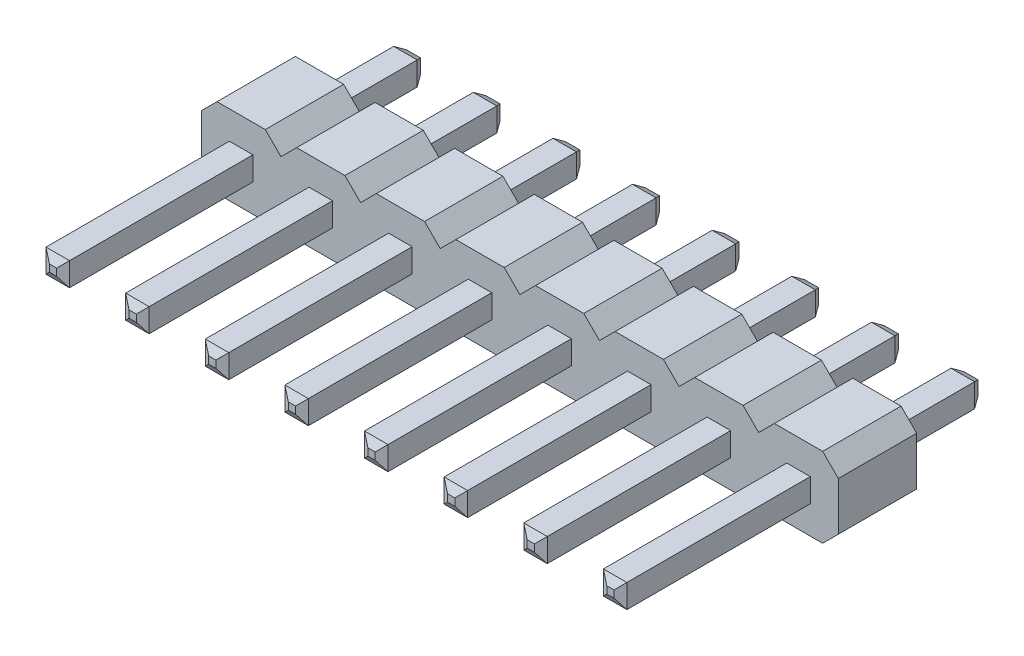
from build123d import *
from OCP.BRepFilletAPI import BRepFilletAPI_MakeChamfer

# Parameters (mm, degrees)
SKICA1_W                     = 0.75
SKICA1_H                     = 0.75
P_IDAT_VYSUNUT_M1_DEPTH      = 2.5
LINPOLE3_COUNT               = 8
LINPOLE3_PITCH               = 2.54
P_IDAT_VYSUNUT_M2_DEPTH      = 6
P_IDAT_VYSUNUT_M2_DEPTH_BACK = 5.5
SKICA2_W                     = 0.75
SKICA2_H                     = 0.75
ZKOSEN_2_SIZE                = 0.15
ZKOSEN_2_SIZE2               = 0.259807621


with BuildPart() as part:
    # Skica1 → Přidat vysunutím1 (new body)
    with BuildSketch(Plane.XY):
        Polygon((0.77, 1.27), (1.27, 0.77), (1.27, -0.77), (0.77, -1.27), (-0.77, -1.27), (-1.27, -0.77), (-1.27, 0.77), (-0.77, 1.27), align=None)
        Rectangle(SKICA1_W, SKICA1_H, mode=Mode.SUBTRACT)
    p_idat_vysunut_m1 = extrude(amount=P_IDAT_VYSUNUT_M1_DEPTH)

    # LinPole3: Přidat vysunutím1 ×8
    with Locations(*[(-i * LINPOLE3_PITCH, 0, 0) for i in range(1, LINPOLE3_COUNT)]):
        add(p_idat_vysunut_m1)

    # Skica2 → Přidat vysunutím2 (add, two sides: drawn at the far end of the back side and taken through both)
    with BuildSketch(Plane.XY.offset(2.5).offset(-P_IDAT_VYSUNUT_M2_DEPTH_BACK)):
        with Locations((-17.78, 0)):
            Rectangle(SKICA2_W, SKICA2_H)
        with Locations((-15.24, 0)):
            Rectangle(SKICA2_W, SKICA2_H)
        with Locations((-12.7, 0)):
            Rectangle(SKICA2_W, SKICA2_H)
        with Locations((-10.16, 0)):
            Rectangle(SKICA2_W, SKICA2_H)
        with Locations((-7.62, 0)):
            Rectangle(SKICA2_W, SKICA2_H)
        with Locations((-5.08, 0)):
            Rectangle(SKICA2_W, SKICA2_H)
        with Locations((-2.54, 0)):
            Rectangle(SKICA2_W, SKICA2_H)
        Rectangle(SKICA2_W, SKICA2_H)
    extrude(amount=P_IDAT_VYSUNUT_M2_DEPTH + P_IDAT_VYSUNUT_M2_DEPTH_BACK)

    # Zkosení2: one chamfer whose edges measure the first distance from different faces: ONE call of the kernel's chamfer builder (chamfer() names one face for all edges)
    zkosen_2_edges_1 = [part.edges().sort_by_distance(p)[0] for p in [
        (0, 0.375, -3),
        (0.375, 0, -3),
        (0, -0.375, -3),
        (-0.375, 0, -3),
    ]]
    zkosen_2_side_1 = [part.faces().sort_by_distance(p)[0] for p in [
        (0, 0, -3),
    ]]
    zkosen_2_edges_2 = [part.edges().sort_by_distance(p)[0] for p in [
        (0, 0.375, 8.5),
    ]]
    zkosen_2_side_2 = [part.faces().sort_by_distance(p)[0] for p in [
        (0, 0.375, 5.5),
    ]]
    zkosen_2_edges_3 = [part.edges().sort_by_distance(p)[0] for p in [
        (-0.375, 0, 8.5),
    ]]
    zkosen_2_side_3 = [part.faces().sort_by_distance(p)[0] for p in [
        (-0.375, 0, 5.5),
    ]]
    zkosen_2_edges_4 = [part.edges().sort_by_distance(p)[0] for p in [
        (0, -0.375, 8.5),
    ]]
    zkosen_2_side_4 = [part.faces().sort_by_distance(p)[0] for p in [
        (0, -0.375, 5.5),
    ]]
    zkosen_2_edges_5 = [part.edges().sort_by_distance(p)[0] for p in [
        (0.375, 0, 8.5),
    ]]
    zkosen_2_side_5 = [part.faces().sort_by_distance(p)[0] for p in [
        (0.375, 0, 5.5),
    ]]
    zkosen_2_edges_6 = [part.edges().sort_by_distance(p)[0] for p in [
        (-2.54, 0.375, -3),
        (-2.165, 0, -3),
        (-2.54, -0.375, -3),
        (-2.915, 0, -3),
    ]]
    zkosen_2_side_6 = [part.faces().sort_by_distance(p)[0] for p in [
        (-2.54, 0, -3),
    ]]
    zkosen_2_edges_7 = [part.edges().sort_by_distance(p)[0] for p in [
        (-2.54, 0.375, 8.5),
    ]]
    zkosen_2_side_7 = [part.faces().sort_by_distance(p)[0] for p in [
        (-2.54, 0.375, 5.5),
    ]]
    zkosen_2_edges_8 = [part.edges().sort_by_distance(p)[0] for p in [
        (-2.915, 0, 8.5),
    ]]
    zkosen_2_side_8 = [part.faces().sort_by_distance(p)[0] for p in [
        (-2.915, 0, 5.5),
    ]]
    zkosen_2_edges_9 = [part.edges().sort_by_distance(p)[0] for p in [
        (-2.54, -0.375, 8.5),
    ]]
    zkosen_2_side_9 = [part.faces().sort_by_distance(p)[0] for p in [
        (-2.54, -0.375, 5.5),
    ]]
    zkosen_2_edges_10 = [part.edges().sort_by_distance(p)[0] for p in [
        (-2.165, 0, 8.5),
    ]]
    zkosen_2_side_10 = [part.faces().sort_by_distance(p)[0] for p in [
        (-2.165, 0, 5.5),
    ]]
    zkosen_2_edges_11 = [part.edges().sort_by_distance(p)[0] for p in [
        (-5.08, 0.375, -3),
        (-4.705, 0, -3),
        (-5.08, -0.375, -3),
        (-5.455, 0, -3),
    ]]
    zkosen_2_side_11 = [part.faces().sort_by_distance(p)[0] for p in [
        (-5.08, 0, -3),
    ]]
    zkosen_2_edges_12 = [part.edges().sort_by_distance(p)[0] for p in [
        (-5.08, 0.375, 8.5),
    ]]
    zkosen_2_side_12 = [part.faces().sort_by_distance(p)[0] for p in [
        (-5.08, 0.375, 5.5),
    ]]
    zkosen_2_edges_13 = [part.edges().sort_by_distance(p)[0] for p in [
        (-5.455, 0, 8.5),
    ]]
    zkosen_2_side_13 = [part.faces().sort_by_distance(p)[0] for p in [
        (-5.455, 0, 5.5),
    ]]
    zkosen_2_edges_14 = [part.edges().sort_by_distance(p)[0] for p in [
        (-5.08, -0.375, 8.5),
    ]]
    zkosen_2_side_14 = [part.faces().sort_by_distance(p)[0] for p in [
        (-5.08, -0.375, 5.5),
    ]]
    zkosen_2_edges_15 = [part.edges().sort_by_distance(p)[0] for p in [
        (-4.705, 0, 8.5),
    ]]
    zkosen_2_side_15 = [part.faces().sort_by_distance(p)[0] for p in [
        (-4.705, 0, 5.5),
    ]]
    zkosen_2_edges_16 = [part.edges().sort_by_distance(p)[0] for p in [
        (-7.62, 0.375, -3),
        (-7.245, 0, -3),
        (-7.62, -0.375, -3),
        (-7.995, 0, -3),
    ]]
    zkosen_2_side_16 = [part.faces().sort_by_distance(p)[0] for p in [
        (-7.62, 0, -3),
    ]]
    zkosen_2_edges_17 = [part.edges().sort_by_distance(p)[0] for p in [
        (-7.62, 0.375, 8.5),
    ]]
    zkosen_2_side_17 = [part.faces().sort_by_distance(p)[0] for p in [
        (-7.62, 0.375, 5.5),
    ]]
    zkosen_2_edges_18 = [part.edges().sort_by_distance(p)[0] for p in [
        (-7.995, 0, 8.5),
    ]]
    zkosen_2_side_18 = [part.faces().sort_by_distance(p)[0] for p in [
        (-7.995, 0, 5.5),
    ]]
    zkosen_2_edges_19 = [part.edges().sort_by_distance(p)[0] for p in [
        (-7.62, -0.375, 8.5),
    ]]
    zkosen_2_side_19 = [part.faces().sort_by_distance(p)[0] for p in [
        (-7.62, -0.375, 5.5),
    ]]
    zkosen_2_edges_20 = [part.edges().sort_by_distance(p)[0] for p in [
        (-7.245, 0, 8.5),
    ]]
    zkosen_2_side_20 = [part.faces().sort_by_distance(p)[0] for p in [
        (-7.245, 0, 5.5),
    ]]
    zkosen_2_edges_21 = [part.edges().sort_by_distance(p)[0] for p in [
        (-10.16, 0.375, -3),
        (-9.785, 0, -3),
        (-10.16, -0.375, -3),
        (-10.535, 0, -3),
    ]]
    zkosen_2_side_21 = [part.faces().sort_by_distance(p)[0] for p in [
        (-10.16, 0, -3),
    ]]
    zkosen_2_edges_22 = [part.edges().sort_by_distance(p)[0] for p in [
        (-10.16, 0.375, 8.5),
    ]]
    zkosen_2_side_22 = [part.faces().sort_by_distance(p)[0] for p in [
        (-10.16, 0.375, 5.5),
    ]]
    zkosen_2_edges_23 = [part.edges().sort_by_distance(p)[0] for p in [
        (-10.535, 0, 8.5),
    ]]
    zkosen_2_side_23 = [part.faces().sort_by_distance(p)[0] for p in [
        (-10.535, 0, 5.5),
    ]]
    zkosen_2_edges_24 = [part.edges().sort_by_distance(p)[0] for p in [
        (-10.16, -0.375, 8.5),
    ]]
    zkosen_2_side_24 = [part.faces().sort_by_distance(p)[0] for p in [
        (-10.16, -0.375, 5.5),
    ]]
    zkosen_2_edges_25 = [part.edges().sort_by_distance(p)[0] for p in [
        (-9.785, 0, 8.5),
    ]]
    zkosen_2_side_25 = [part.faces().sort_by_distance(p)[0] for p in [
        (-9.785, 0, 5.5),
    ]]
    zkosen_2_edges_26 = [part.edges().sort_by_distance(p)[0] for p in [
        (-12.7, 0.375, -3),
        (-12.325, 0, -3),
        (-12.7, -0.375, -3),
        (-13.075, 0, -3),
    ]]
    zkosen_2_side_26 = [part.faces().sort_by_distance(p)[0] for p in [
        (-12.7, 0, -3),
    ]]
    zkosen_2_edges_27 = [part.edges().sort_by_distance(p)[0] for p in [
        (-12.7, 0.375, 8.5),
    ]]
    zkosen_2_side_27 = [part.faces().sort_by_distance(p)[0] for p in [
        (-12.7, 0.375, 5.5),
    ]]
    zkosen_2_edges_28 = [part.edges().sort_by_distance(p)[0] for p in [
        (-13.075, 0, 8.5),
    ]]
    zkosen_2_side_28 = [part.faces().sort_by_distance(p)[0] for p in [
        (-13.075, 0, 5.5),
    ]]
    zkosen_2_edges_29 = [part.edges().sort_by_distance(p)[0] for p in [
        (-12.7, -0.375, 8.5),
    ]]
    zkosen_2_side_29 = [part.faces().sort_by_distance(p)[0] for p in [
        (-12.7, -0.375, 5.5),
    ]]
    zkosen_2_edges_30 = [part.edges().sort_by_distance(p)[0] for p in [
        (-12.325, 0, 8.5),
    ]]
    zkosen_2_side_30 = [part.faces().sort_by_distance(p)[0] for p in [
        (-12.325, 0, 5.5),
    ]]
    zkosen_2_edges_31 = [part.edges().sort_by_distance(p)[0] for p in [
        (-18.155, 0, -3),
        (-17.78, 0.375, -3),
        (-17.405, 0, -3),
        (-17.78, -0.375, -3),
    ]]
    zkosen_2_side_31 = [part.faces().sort_by_distance(p)[0] for p in [
        (-17.78, 0, -3),
    ]]
    zkosen_2_edges_32 = [part.edges().sort_by_distance(p)[0] for p in [
        (-18.155, 0, 8.5),
    ]]
    zkosen_2_side_32 = [part.faces().sort_by_distance(p)[0] for p in [
        (-18.155, 0, 5.5),
    ]]
    zkosen_2_edges_33 = [part.edges().sort_by_distance(p)[0] for p in [
        (-17.78, -0.375, 8.5),
    ]]
    zkosen_2_side_33 = [part.faces().sort_by_distance(p)[0] for p in [
        (-17.78, -0.375, 5.5),
    ]]
    zkosen_2_edges_34 = [part.edges().sort_by_distance(p)[0] for p in [
        (-17.405, 0, 8.5),
    ]]
    zkosen_2_side_34 = [part.faces().sort_by_distance(p)[0] for p in [
        (-17.405, 0, 5.5),
    ]]
    zkosen_2_edges_35 = [part.edges().sort_by_distance(p)[0] for p in [
        (-17.78, 0.375, 8.5),
    ]]
    zkosen_2_side_35 = [part.faces().sort_by_distance(p)[0] for p in [
        (-17.78, 0.375, 5.5),
    ]]
    zkosen_2_edges_36 = [part.edges().sort_by_distance(p)[0] for p in [
        (-15.24, -0.375, -3),
        (-15.615, 0, -3),
        (-15.24, 0.375, -3),
        (-14.865, 0, -3),
    ]]
    zkosen_2_side_36 = [part.faces().sort_by_distance(p)[0] for p in [
        (-15.24, 0, -3),
    ]]
    zkosen_2_edges_37 = [part.edges().sort_by_distance(p)[0] for p in [
        (-15.24, -0.375, 8.5),
    ]]
    zkosen_2_side_37 = [part.faces().sort_by_distance(p)[0] for p in [
        (-15.24, -0.375, 5.5),
    ]]
    zkosen_2_edges_38 = [part.edges().sort_by_distance(p)[0] for p in [
        (-14.865, 0, 8.5),
    ]]
    zkosen_2_side_38 = [part.faces().sort_by_distance(p)[0] for p in [
        (-14.865, 0, 5.5),
    ]]
    zkosen_2_edges_39 = [part.edges().sort_by_distance(p)[0] for p in [
        (-15.24, 0.375, 8.5),
    ]]
    zkosen_2_side_39 = [part.faces().sort_by_distance(p)[0] for p in [
        (-15.24, 0.375, 5.5),
    ]]
    zkosen_2_edges_40 = [part.edges().sort_by_distance(p)[0] for p in [
        (-15.615, 0, 8.5),
    ]]
    zkosen_2_side_40 = [part.faces().sort_by_distance(p)[0] for p in [
        (-15.615, 0, 5.5),
    ]]
    zkosen_2 = BRepFilletAPI_MakeChamfer(part.part.solid().wrapped)
    for e in zkosen_2_edges_1:
        zkosen_2.Add(ZKOSEN_2_SIZE, ZKOSEN_2_SIZE2, e.wrapped, zkosen_2_side_1[0].wrapped)  # the first distance lies on this face
    for e in zkosen_2_edges_2:
        zkosen_2.Add(ZKOSEN_2_SIZE, ZKOSEN_2_SIZE2, e.wrapped, zkosen_2_side_2[0].wrapped)  # the first distance lies on this face
    for e in zkosen_2_edges_3:
        zkosen_2.Add(ZKOSEN_2_SIZE, ZKOSEN_2_SIZE2, e.wrapped, zkosen_2_side_3[0].wrapped)  # the first distance lies on this face
    for e in zkosen_2_edges_4:
        zkosen_2.Add(ZKOSEN_2_SIZE, ZKOSEN_2_SIZE2, e.wrapped, zkosen_2_side_4[0].wrapped)  # the first distance lies on this face
    for e in zkosen_2_edges_5:
        zkosen_2.Add(ZKOSEN_2_SIZE, ZKOSEN_2_SIZE2, e.wrapped, zkosen_2_side_5[0].wrapped)  # the first distance lies on this face
    for e in zkosen_2_edges_6:
        zkosen_2.Add(ZKOSEN_2_SIZE, ZKOSEN_2_SIZE2, e.wrapped, zkosen_2_side_6[0].wrapped)  # the first distance lies on this face
    for e in zkosen_2_edges_7:
        zkosen_2.Add(ZKOSEN_2_SIZE, ZKOSEN_2_SIZE2, e.wrapped, zkosen_2_side_7[0].wrapped)  # the first distance lies on this face
    for e in zkosen_2_edges_8:
        zkosen_2.Add(ZKOSEN_2_SIZE, ZKOSEN_2_SIZE2, e.wrapped, zkosen_2_side_8[0].wrapped)  # the first distance lies on this face
    for e in zkosen_2_edges_9:
        zkosen_2.Add(ZKOSEN_2_SIZE, ZKOSEN_2_SIZE2, e.wrapped, zkosen_2_side_9[0].wrapped)  # the first distance lies on this face
    for e in zkosen_2_edges_10:
        zkosen_2.Add(ZKOSEN_2_SIZE, ZKOSEN_2_SIZE2, e.wrapped, zkosen_2_side_10[0].wrapped)  # the first distance lies on this face
    for e in zkosen_2_edges_11:
        zkosen_2.Add(ZKOSEN_2_SIZE, ZKOSEN_2_SIZE2, e.wrapped, zkosen_2_side_11[0].wrapped)  # the first distance lies on this face
    for e in zkosen_2_edges_12:
        zkosen_2.Add(ZKOSEN_2_SIZE, ZKOSEN_2_SIZE2, e.wrapped, zkosen_2_side_12[0].wrapped)  # the first distance lies on this face
    for e in zkosen_2_edges_13:
        zkosen_2.Add(ZKOSEN_2_SIZE, ZKOSEN_2_SIZE2, e.wrapped, zkosen_2_side_13[0].wrapped)  # the first distance lies on this face
    for e in zkosen_2_edges_14:
        zkosen_2.Add(ZKOSEN_2_SIZE, ZKOSEN_2_SIZE2, e.wrapped, zkosen_2_side_14[0].wrapped)  # the first distance lies on this face
    for e in zkosen_2_edges_15:
        zkosen_2.Add(ZKOSEN_2_SIZE, ZKOSEN_2_SIZE2, e.wrapped, zkosen_2_side_15[0].wrapped)  # the first distance lies on this face
    for e in zkosen_2_edges_16:
        zkosen_2.Add(ZKOSEN_2_SIZE, ZKOSEN_2_SIZE2, e.wrapped, zkosen_2_side_16[0].wrapped)  # the first distance lies on this face
    for e in zkosen_2_edges_17:
        zkosen_2.Add(ZKOSEN_2_SIZE, ZKOSEN_2_SIZE2, e.wrapped, zkosen_2_side_17[0].wrapped)  # the first distance lies on this face
    for e in zkosen_2_edges_18:
        zkosen_2.Add(ZKOSEN_2_SIZE, ZKOSEN_2_SIZE2, e.wrapped, zkosen_2_side_18[0].wrapped)  # the first distance lies on this face
    for e in zkosen_2_edges_19:
        zkosen_2.Add(ZKOSEN_2_SIZE, ZKOSEN_2_SIZE2, e.wrapped, zkosen_2_side_19[0].wrapped)  # the first distance lies on this face
    for e in zkosen_2_edges_20:
        zkosen_2.Add(ZKOSEN_2_SIZE, ZKOSEN_2_SIZE2, e.wrapped, zkosen_2_side_20[0].wrapped)  # the first distance lies on this face
    for e in zkosen_2_edges_21:
        zkosen_2.Add(ZKOSEN_2_SIZE, ZKOSEN_2_SIZE2, e.wrapped, zkosen_2_side_21[0].wrapped)  # the first distance lies on this face
    for e in zkosen_2_edges_22:
        zkosen_2.Add(ZKOSEN_2_SIZE, ZKOSEN_2_SIZE2, e.wrapped, zkosen_2_side_22[0].wrapped)  # the first distance lies on this face
    for e in zkosen_2_edges_23:
        zkosen_2.Add(ZKOSEN_2_SIZE, ZKOSEN_2_SIZE2, e.wrapped, zkosen_2_side_23[0].wrapped)  # the first distance lies on this face
    for e in zkosen_2_edges_24:
        zkosen_2.Add(ZKOSEN_2_SIZE, ZKOSEN_2_SIZE2, e.wrapped, zkosen_2_side_24[0].wrapped)  # the first distance lies on this face
    for e in zkosen_2_edges_25:
        zkosen_2.Add(ZKOSEN_2_SIZE, ZKOSEN_2_SIZE2, e.wrapped, zkosen_2_side_25[0].wrapped)  # the first distance lies on this face
    for e in zkosen_2_edges_26:
        zkosen_2.Add(ZKOSEN_2_SIZE, ZKOSEN_2_SIZE2, e.wrapped, zkosen_2_side_26[0].wrapped)  # the first distance lies on this face
    for e in zkosen_2_edges_27:
        zkosen_2.Add(ZKOSEN_2_SIZE, ZKOSEN_2_SIZE2, e.wrapped, zkosen_2_side_27[0].wrapped)  # the first distance lies on this face
    for e in zkosen_2_edges_28:
        zkosen_2.Add(ZKOSEN_2_SIZE, ZKOSEN_2_SIZE2, e.wrapped, zkosen_2_side_28[0].wrapped)  # the first distance lies on this face
    for e in zkosen_2_edges_29:
        zkosen_2.Add(ZKOSEN_2_SIZE, ZKOSEN_2_SIZE2, e.wrapped, zkosen_2_side_29[0].wrapped)  # the first distance lies on this face
    for e in zkosen_2_edges_30:
        zkosen_2.Add(ZKOSEN_2_SIZE, ZKOSEN_2_SIZE2, e.wrapped, zkosen_2_side_30[0].wrapped)  # the first distance lies on this face
    for e in zkosen_2_edges_31:
        zkosen_2.Add(ZKOSEN_2_SIZE, ZKOSEN_2_SIZE2, e.wrapped, zkosen_2_side_31[0].wrapped)  # the first distance lies on this face
    for e in zkosen_2_edges_32:
        zkosen_2.Add(ZKOSEN_2_SIZE, ZKOSEN_2_SIZE2, e.wrapped, zkosen_2_side_32[0].wrapped)  # the first distance lies on this face
    for e in zkosen_2_edges_33:
        zkosen_2.Add(ZKOSEN_2_SIZE, ZKOSEN_2_SIZE2, e.wrapped, zkosen_2_side_33[0].wrapped)  # the first distance lies on this face
    for e in zkosen_2_edges_34:
        zkosen_2.Add(ZKOSEN_2_SIZE, ZKOSEN_2_SIZE2, e.wrapped, zkosen_2_side_34[0].wrapped)  # the first distance lies on this face
    for e in zkosen_2_edges_35:
        zkosen_2.Add(ZKOSEN_2_SIZE, ZKOSEN_2_SIZE2, e.wrapped, zkosen_2_side_35[0].wrapped)  # the first distance lies on this face
    for e in zkosen_2_edges_36:
        zkosen_2.Add(ZKOSEN_2_SIZE, ZKOSEN_2_SIZE2, e.wrapped, zkosen_2_side_36[0].wrapped)  # the first distance lies on this face
    for e in zkosen_2_edges_37:
        zkosen_2.Add(ZKOSEN_2_SIZE, ZKOSEN_2_SIZE2, e.wrapped, zkosen_2_side_37[0].wrapped)  # the first distance lies on this face
    for e in zkosen_2_edges_38:
        zkosen_2.Add(ZKOSEN_2_SIZE, ZKOSEN_2_SIZE2, e.wrapped, zkosen_2_side_38[0].wrapped)  # the first distance lies on this face
    for e in zkosen_2_edges_39:
        zkosen_2.Add(ZKOSEN_2_SIZE, ZKOSEN_2_SIZE2, e.wrapped, zkosen_2_side_39[0].wrapped)  # the first distance lies on this face
    for e in zkosen_2_edges_40:
        zkosen_2.Add(ZKOSEN_2_SIZE, ZKOSEN_2_SIZE2, e.wrapped, zkosen_2_side_40[0].wrapped)  # the first distance lies on this face
    add(Compound.cast(zkosen_2.Shape()), mode=Mode.REPLACE)


solid = part.part
